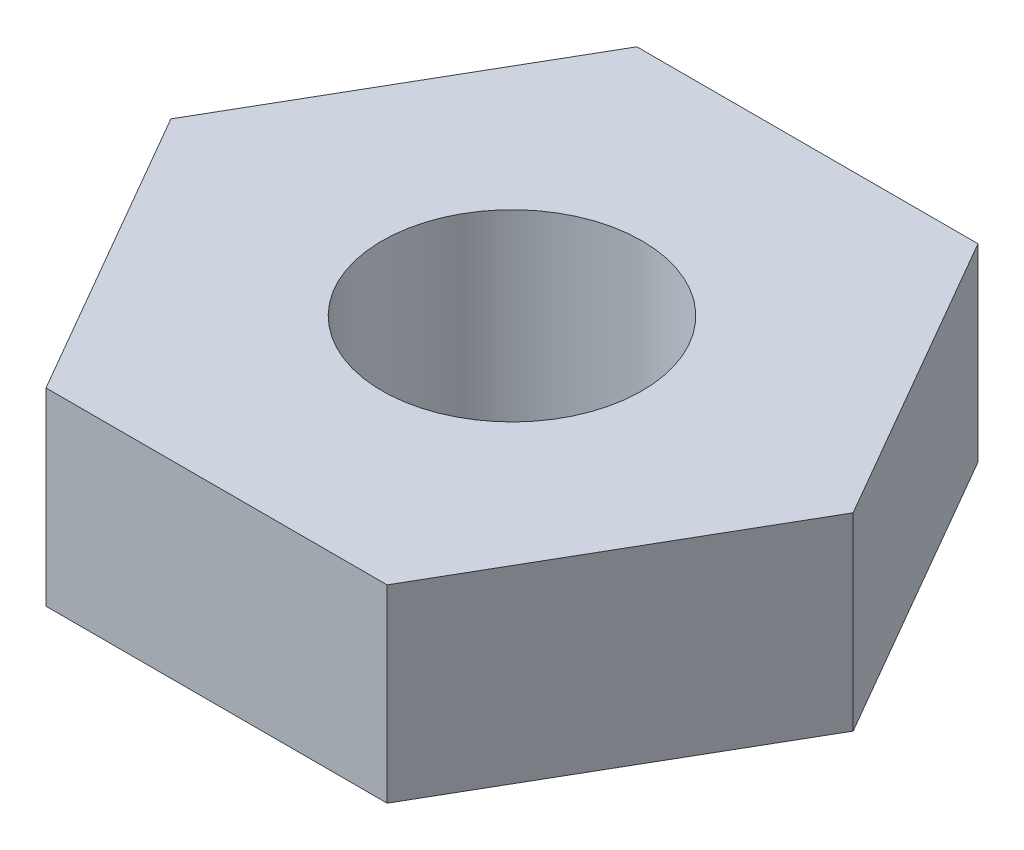
from build123d import *

# Parameters (mm, degrees)
BOSS_EXTRUDE1_DEPTH = 0.8
SKETCH2_R           = 0.55
CUT_EXTRUDE1_DEPTH  = 3.070225667


with BuildPart() as part:
    # Sketch1 → Boss-Extrude1 (new body)
    with BuildSketch(Plane(origin=(0, 0, 0), x_dir=(1, 0, 0), z_dir=(0, 1, 0))):
        Polygon((-0.721687934, 1.250000168), (-1.443375867, 0), (-0.721687934, -1.250000168), (0.721687934, -1.250000168), (1.443375867, 0), (0.721687934, 1.250000168), align=None)
    extrude(amount=BOSS_EXTRUDE1_DEPTH)

    # Sketch2 → Cut-Extrude1 (cut, through all)
    with BuildSketch(Plane.XZ):
        with Locations(Location((0, 0, 0), (0, 0, 270))):
            Circle(SKETCH2_R)
    extrude(amount=-CUT_EXTRUDE1_DEPTH, mode=Mode.SUBTRACT)


solid = part.part
